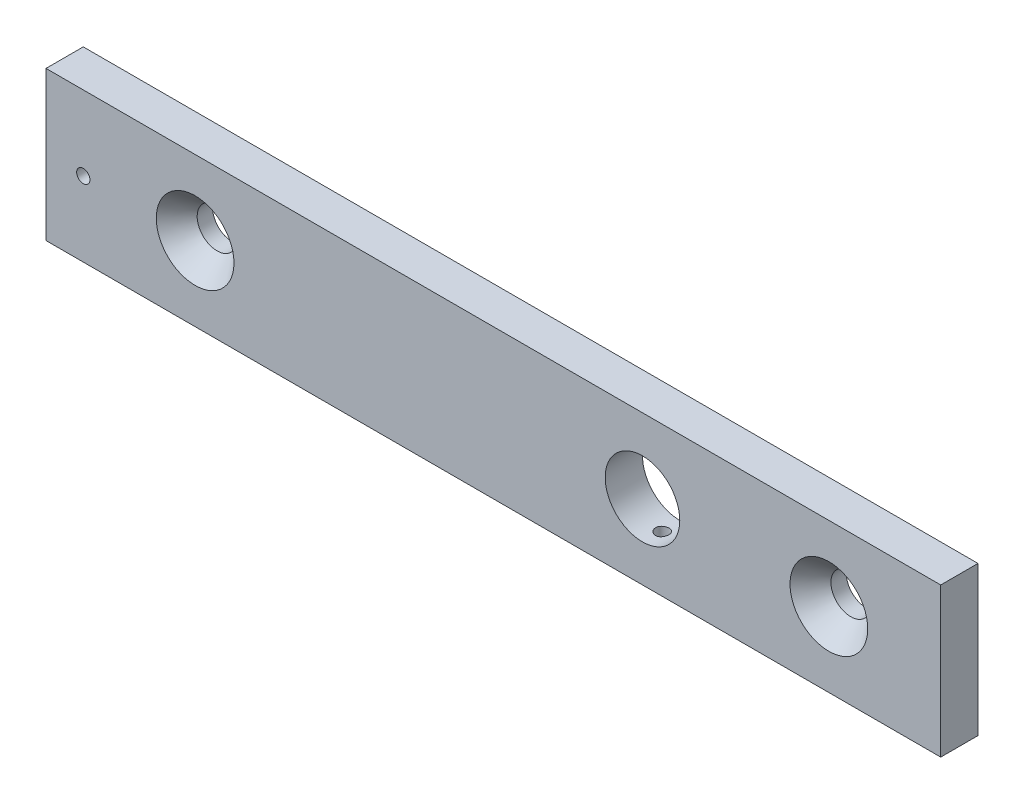
from build123d import *

# Parameters (mm, degrees)
SKETCH1_W                  = 152.4
SKETCH1_H                  = 25.4
EXTRUDE1_DEPTH             = 6.35
F_4_40_TAPPED_HOLE2_D      = 2.2606
F_4_40_TAPPED_HOLE2_DEPTH  = 3.302
F_4_40_TAPPED_HOLE2_TIP    = 0.679152758
F_1_2_0_5_DIAMETER_HOLE1_D = 12.7
F_4_40_TAPPED_HOLE3_D      = 2.2606
F_4_40_TAPPED_HOLE3_DEPTH  = 8.89
F_4_40_TAPPED_HOLE3_TIP    = 0.679152758


with BuildPart() as part:
    # Sketch1 → Extrude1 (new body)
    with BuildSketch(Plane.XY):
        Rectangle(SKETCH1_W, SKETCH1_H)
    extrude(amount=EXTRUDE1_DEPTH)

    # #4-40 Tapped Hole2
    with Locations(Plane(origin=(-69.85, 0, 6.35), x_dir=(1, 0, 0), z_dir=(0, 0, 1))):
        with Locations((0, 0)):
            Hole(F_4_40_TAPPED_HOLE2_D / 2, depth=F_4_40_TAPPED_HOLE2_DEPTH)
            with Locations((0, 0, -(F_4_40_TAPPED_HOLE2_DEPTH + F_4_40_TAPPED_HOLE2_TIP / 2))):  # 118° drill point
                Cone(0, F_4_40_TAPPED_HOLE2_D / 2, F_4_40_TAPPED_HOLE2_TIP, mode=Mode.SUBTRACT)

    # 1/2 (0.5) Diameter Hole1 (through all)
    with Locations(Plane(origin=(25.4, 0, 6.35), x_dir=(1, 0, 0), z_dir=(0, 0, 1))):
        with Locations((0, 0)):
            Hole(F_1_2_0_5_DIAMETER_HOLE1_D / 2)

    # #4-40 Tapped Hole3
    with Locations(Plane(origin=(25.610669662, -12.7, 3.178918451), x_dir=(0, 0, -1), z_dir=(0, -1, 0))):
        with Locations((0, 0)):
            Hole(F_4_40_TAPPED_HOLE3_D / 2, depth=F_4_40_TAPPED_HOLE3_DEPTH)
            with Locations((0, 0, -(F_4_40_TAPPED_HOLE3_DEPTH + F_4_40_TAPPED_HOLE3_TIP / 2))):  # 118° drill point
                Cone(0, F_4_40_TAPPED_HOLE3_D / 2, F_4_40_TAPPED_HOLE3_TIP, mode=Mode.SUBTRACT)

    # Sketch17 → CSK for 1/4 Flat Head Socket Cap Screw4 (revolve, cut)
    with BuildSketch(Plane(origin=(-50.8, 0, 6.35), x_dir=(0, -1, 0), z_dir=(1, 0, 0))):
        Polygon((0, 0), (0, 6.35), (3.3782, 6.35), (3.3782, 3.728390023), (6.61924, 0), align=None)
    revolve(axis=Axis((-50.8, 0, 12.7), (0, 0, -1)), mode=Mode.SUBTRACT)

    # Sketch19 → CSK for 1/4 Flat Head Socket Cap Screw5 (revolve, cut)
    with BuildSketch(Plane(origin=(57.15, 0, 6.35), x_dir=(0, -1, 0), z_dir=(1, 0, 0))):
        Polygon((0, 0), (0, 6.35), (3.3782, 6.35), (3.3782, 3.728390023), (6.61924, 0), align=None)
    revolve(axis=Axis((57.15, 0, 12.7), (0, 0, -1)), mode=Mode.SUBTRACT)


solid = part.part
